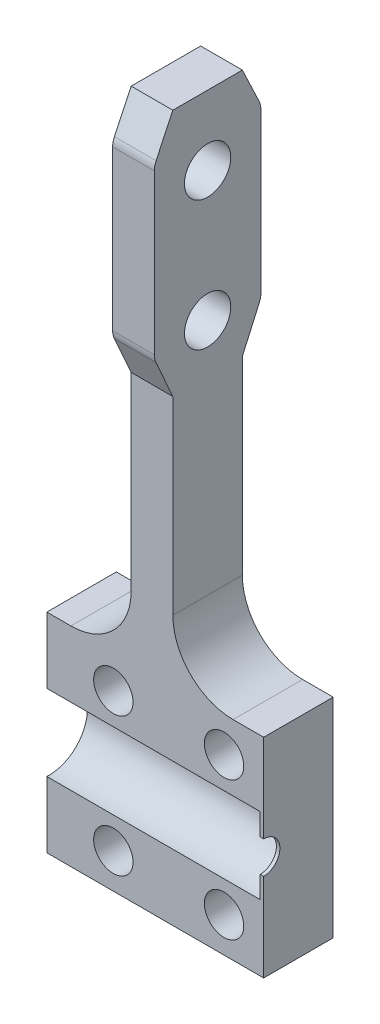
from build123d import *

# Parameters (mm, degrees)
SKETCH1_R           = 4.25
BOSS_EXTRUDE1_DEPTH = 15
SKETCH3_R           = 8.25
CUT_EXTRUDE1_DEPTH  = 46.05
SKETCH4_R           = 5
CUT_EXTRUDE3_DEPTH  = 46.05
SKETCH5_R           = 3.5
CUT_EXTRUDE4_DEPTH  = 46.05
BOSS_EXTRUDE2_DEPTH = 9
FILLET1_R           = 13


with BuildPart() as part:
    # Sketch1 → Boss-Extrude1 (new body)
    with BuildSketch(Plane.XY):
        with BuildLine():
            Line((-8.1, 22.5), (-8.1, 129.9))
            Line((-8.1, 129.9), (0.9, 129.9))
            Line((0.9, 129.9), (0.9, 35.5))
            ThreePointArc((0.9, 35.5), (4.707611845, 26.307611845), (13.9, 22.5))
            Line((13.9, 22.5), (20.5, 22.5))
            Line((20.5, 22.5), (20.5, -22.5))
            Line((20.5, -22.5), (-26.3, -22.5))
            Line((-26.3, -22.5), (-26.3, 22.5))
            Line((-26.3, 22.5), (-8.1, 22.5))
        make_face()
        with Locations((-11.95, -14.95)):
            Circle(SKETCH1_R, mode=Mode.SUBTRACT)
        with Locations((11.95, -14.95)):
            Circle(SKETCH1_R, mode=Mode.SUBTRACT)
        with Locations((11.95, 14.95)):
            Circle(SKETCH1_R, mode=Mode.SUBTRACT)
        with Locations((-11.95, 14.95)):
            Circle(SKETCH1_R, mode=Mode.SUBTRACT)
    extrude(amount=BOSS_EXTRUDE1_DEPTH)

    # Sketch3 → Cut-Extrude1 (cut)
    with BuildSketch(Plane.ZY.offset(26.3)):
        with Locations((14.5, 0)):
            Circle(SKETCH3_R)
    extrude(amount=-CUT_EXTRUDE1_DEPTH, mode=Mode.SUBTRACT)

    # Sketch4 → Cut-Extrude3 (cut)
    with BuildSketch(Plane(origin=(0.9, 0, 0), x_dir=(0, 0, -1), z_dir=(1, 0, 0))):
        with Locations((-7.5, 86.9)):
            Circle(SKETCH4_R)
        with Locations((-7.5, 114.9)):
            Circle(SKETCH4_R)
    extrude(amount=-CUT_EXTRUDE3_DEPTH, mode=Mode.SUBTRACT)

    # Sketch5 → Cut-Extrude4 (cut)
    with BuildSketch(Plane(origin=(20.5, 0, 0), x_dir=(0, 0, -1), z_dir=(1, 0, 0))):
        with Locations((-15, 0)):
            Circle(SKETCH5_R)
    extrude(amount=-CUT_EXTRUDE4_DEPTH, mode=Mode.SUBTRACT)

    # Sketch6 → Boss-Extrude2 (add)
    with BuildSketch(Plane.ZY.offset(8.1)):
        with BuildLine():
            Line((15, 76.386851455), (18.651630299, 84.554112306))
            ThreePointArc((18.651630299, 84.554112306), (18.911938215, 85.352068488), (19, 86.186777661))
            Line((19, 86.186777661), (19, 120.550049196))
            ThreePointArc((19, 120.550049196), (18.902685036, 121.427003874), (18.615475246, 122.261288146))
            Line((18.615475246, 122.261288146), (15, 129.9))
            Line((15, 129.9), (15, 76.386851455))
        make_face()
        with BuildLine():
            Line((-3.615475246, 122.261288146), (0, 129.9))
            Line((0, 129.9), (0, 76.386851455))
            Line((0, 76.386851455), (-3.651630299, 84.554112306))
            ThreePointArc((-3.651630299, 84.554112306), (-3.911938215, 85.352068488), (-4, 86.186777661))
            Line((-4, 86.186777661), (-4, 120.550049196))
            ThreePointArc((-4, 120.550049196), (-3.902685036, 121.427003874), (-3.615475246, 122.261288146))
        make_face()
    extrude(amount=-BOSS_EXTRUDE2_DEPTH)

    # Fillet1
    fillet1_edges = [part.edges().sort_by_distance(p)[0] for p in [
        (-8.1, 22.5, 7.5),
    ]]
    fillet(fillet1_edges, radius=FILLET1_R)


solid = part.part
